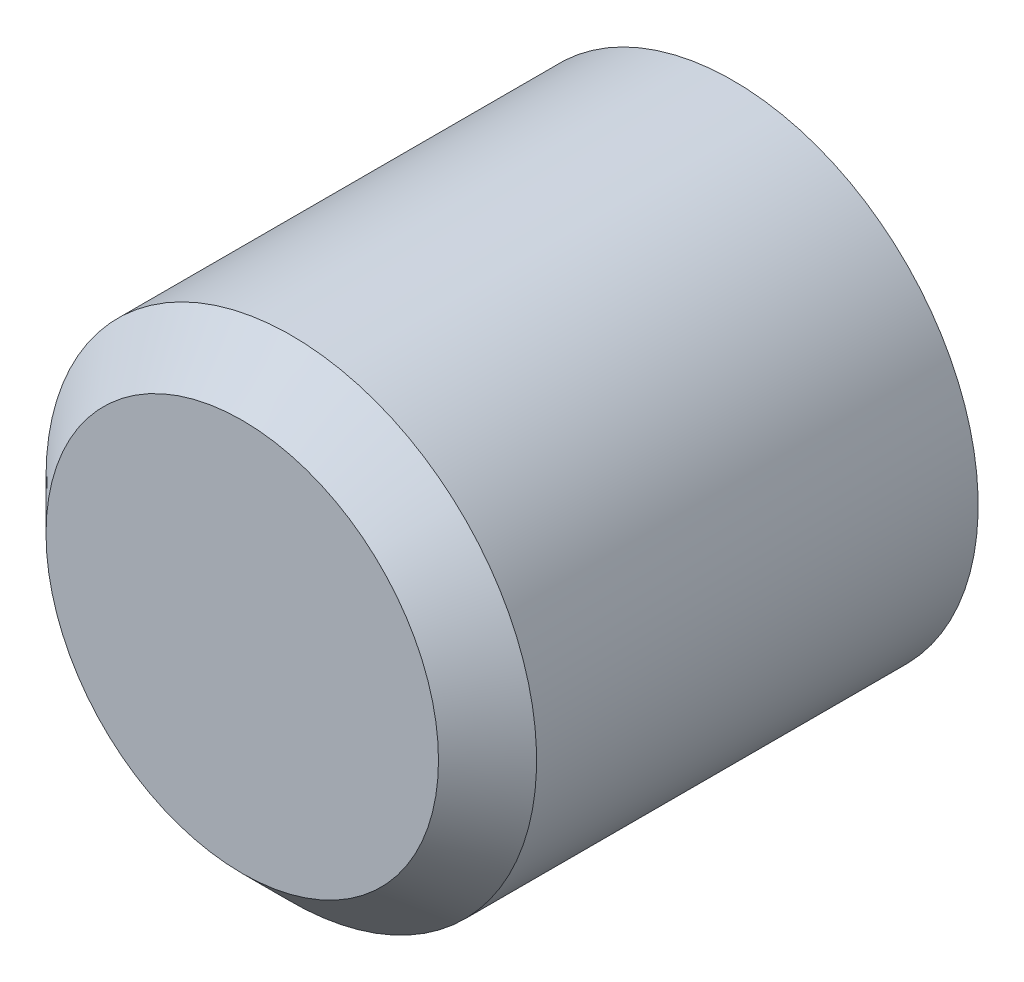
from build123d import *


with BuildPart() as part:
    # sketch:main-profile → feature:chamfer-profile (revolve)
    with BuildSketch(Plane.XZ, mode=Mode.PRIVATE) as feature_chamfer_profile_sk:
        Polygon((0, 0), (10, 0), (10, 18), (8, 20), (0, 20), align=None)
    revolve(feature_chamfer_profile_sk.sketch.rotate(Axis((0, 0, -5), (0, 0, 1)), 180), axis=Axis((0, 0, -5), (0, 0, 1)))


solid = part.part
